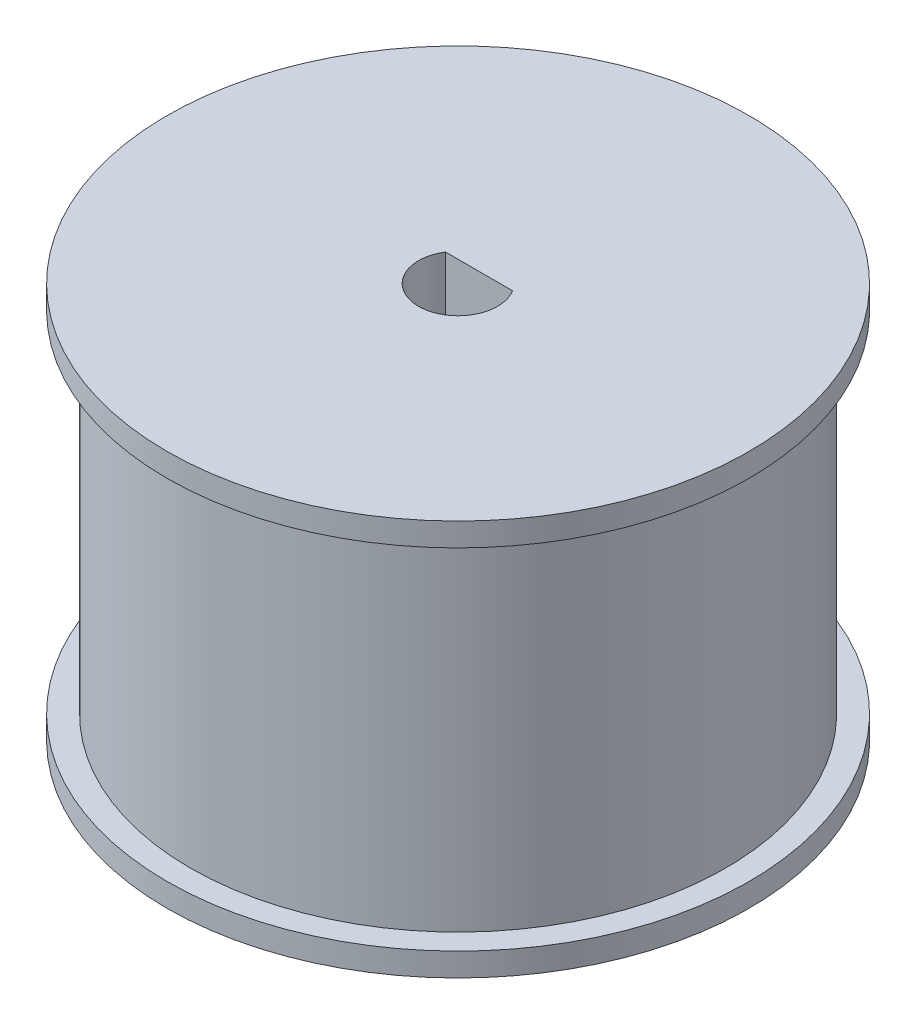
from build123d import *

# Parameters (mm, degrees)
ESBO_O1_R                = 12.5
RESSALTO_EXTRUS_O1_DEPTH = 1
ESBO_O2_R                = 11.5
RESSALTO_EXTRUS_O2_DEPTH = 15
ESBO_O3_R                = 12.5
RESSALTO_EXTRUS_O3_DEPTH = 1
CORTE_EXTRUS_O1_DEPTH    = 12
CORTE_EXTRUS_O2_DEPTH    = 35
CORTE_EXTRUS_O3_START    = -5
ESBO_O7_R                = 2.75
CORTE_EXTRUS_O3_DEPTH    = 35
ESBO_O8_R                = 9.5
CORTE_EXTRUS_O4_DEPTH    = 11
ESBO_O9_W                = 5.8
ESBO_O9_H                = 2.5
CORTE_EXTRUS_O5_DEPTH    = 4.8


with BuildPart() as part:
    # Esboço1 → Ressalto-extrusão1 (new body)
    with BuildSketch(Plane(origin=(0, 0, 0), x_dir=(1, 0, 0), z_dir=(0, 1, 0))):
        with Locations(Location((0, 0, 0), (0, 0, 270))):
            Circle(ESBO_O1_R)
    extrude(amount=RESSALTO_EXTRUS_O1_DEPTH)

    # Esboço2 → Ressalto-extrusão2 (add)
    with BuildSketch(Plane(origin=(0, 1, 0), x_dir=(1, 0, 0), z_dir=(0, 1, 0))):
        with Locations(Location((0, 0, 0), (0, 0, 270))):
            Circle(ESBO_O2_R)
    extrude(amount=RESSALTO_EXTRUS_O2_DEPTH)

    # Esboço3 → Ressalto-extrusão3 (add)
    with BuildSketch(Plane(origin=(0, 16, 0), x_dir=(1, 0, 0), z_dir=(0, 1, 0))):
        with Locations(Location((0, 0, 0), (0, 0, 270))):
            Circle(ESBO_O3_R)
    extrude(amount=RESSALTO_EXTRUS_O3_DEPTH)

    # Esboço4 → Corte-extrusão1 (cut)
    with BuildSketch(Plane(origin=(0, 17, 0), x_dir=(1, 0, 0), z_dir=(0, 1, 0))):
        with BuildLine():
            ThreePointArc((-1.44222051, 0.9), (-1.486606875, -0.824621125), (0, -1.7))
            Line((0, -1.7), (0, 0.9))
            Line((0, 0.9), (-1.44222051, 0.9))
        make_face()
        with BuildLine():
            Line((0, 0.9), (0, -1.7))
            ThreePointArc((0, -1.7), (1.202081528, -1.202081528), (1.7, 0))
            ThreePointArc((1.7, 0), (1.634284992, 0.468094613), (1.44222051, 0.9))
            Line((1.44222051, 0.9), (0, 0.9))
        make_face()
    extrude(amount=-CORTE_EXTRUS_O1_DEPTH, mode=Mode.SUBTRACT)

    # Esboço6 → Corte-extrusão2 (cut)
    with BuildSketch(Plane.XY):
        with BuildLine():
            ThreePointArc((0, 14.5), (-1.5, 13), (0, 11.5))
            Line((0, 11.5), (0, 13))
            Line((0, 13), (0, 14.5))
        make_face()
        with BuildLine():
            Line((0, 13), (0, 11.5))
            ThreePointArc((0, 11.5), (1.060660172, 11.939339828), (1.5, 13))
            ThreePointArc((1.5, 13), (1.060660172, 14.060660172), (0, 14.5))
            Line((0, 14.5), (0, 13))
        make_face()
    extrude(amount=-CORTE_EXTRUS_O2_DEPTH, mode=Mode.SUBTRACT)

    # Esboço7 → Corte-extrusão3 (cut)
    with BuildSketch(Plane.XY.offset(CORTE_EXTRUS_O3_START)):
        with Locations((0, 13)):
            Circle(ESBO_O7_R)
    extrude(amount=-CORTE_EXTRUS_O3_DEPTH, mode=Mode.SUBTRACT)

    # Esboço8 → Corte-extrusão4 (cut)
    with BuildSketch(Plane(origin=(0, 0, 0), x_dir=(-1, 0, 0), z_dir=(0, -1, 0))):
        with Locations(Location((0, 0, 0), (0, 0, 90))):
            Circle(ESBO_O8_R)
    extrude(amount=-CORTE_EXTRUS_O4_DEPTH, mode=Mode.SUBTRACT)

    # Esboço9 → Corte-extrusão5 (cut)
    with BuildSketch(Plane.XZ.offset(-11)):
        with Locations((0, -2.700284177)):
            Rectangle(ESBO_O9_W, ESBO_O9_H)
    extrude(amount=-CORTE_EXTRUS_O5_DEPTH, mode=Mode.SUBTRACT)


solid = part.part
